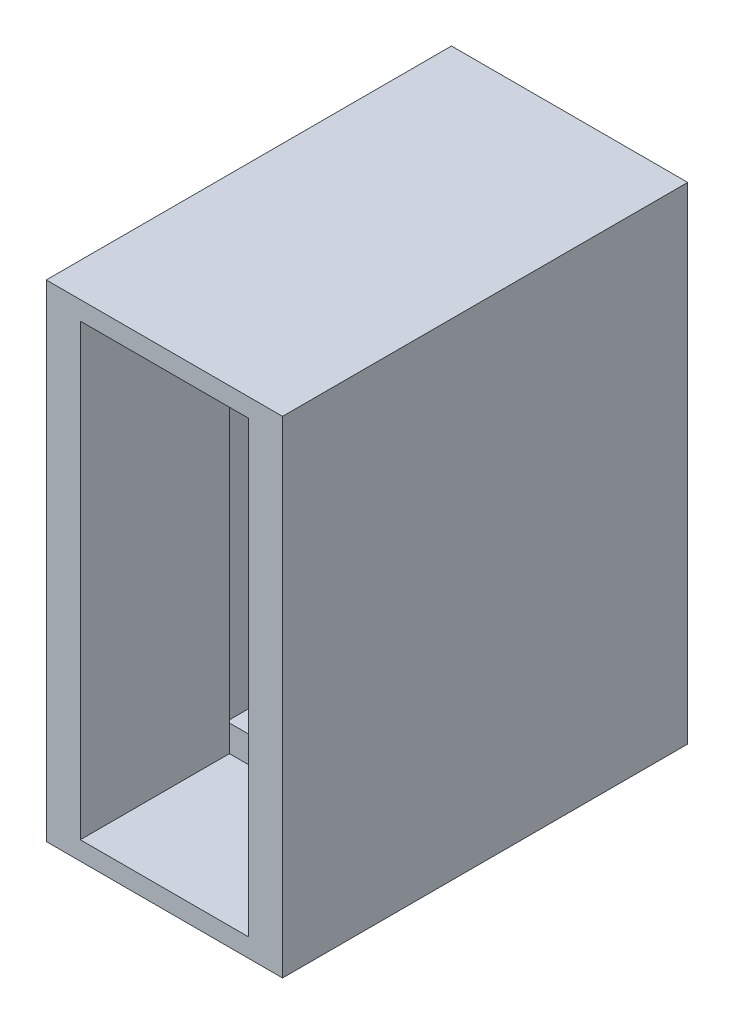
from build123d import *

# Parameters (mm, degrees)
SKETCH2_W           = 17
SKETCH2_H           = 35
BOSS_EXTRUDE1_DEPTH = 40
SKETCH3_W           = 12.1
SKETCH3_H           = 32.32
CUT_EXTRUDE1_DEPTH  = 10.73
SKETCH4_W           = 12.5
SKETCH4_H           = 28.5
CUT_EXTRUDE2_DEPTH  = 17
SKETCH6_W           = 9
SKETCH6_H           = 6.5
CUT_EXTRUDE3_DEPTH  = 17
SKETCH7_W           = 10.843475329
SKETCH7_H           = 35
CUT_EXTRUDE4_DEPTH  = 56.803225713


with BuildPart() as part:
    # Sketch2 → Boss-Extrude1 (new body)
    with BuildSketch(Plane.XY):
        with Locations((-8.5, 17.5)):
            Rectangle(SKETCH2_W, SKETCH2_H)
    extrude(amount=BOSS_EXTRUDE1_DEPTH)

    # Sketch3 → Cut-Extrude1 (cut)
    with BuildSketch(Plane.XY.offset(40)):
        with Locations((-8.5, 17.5)):
            Rectangle(SKETCH3_W, SKETCH3_H)
    extrude(amount=-CUT_EXTRUDE1_DEPTH, mode=Mode.SUBTRACT)

    # Sketch4 → Cut-Extrude2 (cut)
    with BuildSketch(Plane.XY.offset(29.27)):
        with Locations((-8.5, 17.5)):
            Rectangle(SKETCH4_W, SKETCH4_H)
    extrude(amount=-CUT_EXTRUDE2_DEPTH, mode=Mode.SUBTRACT)

    # Sketch6 → Cut-Extrude3 (cut)
    with BuildSketch(Plane(origin=(0, 3.25, 0), x_dir=(1, 0, 0), z_dir=(0, 1, 0))):
        with Locations((-8.5, -17.044771265)):
            Rectangle(SKETCH6_W, SKETCH6_H)
    extrude(amount=-CUT_EXTRUDE3_DEPTH, mode=Mode.SUBTRACT)

    # Sketch7 → Cut-Extrude4 (cut, through all)
    with BuildSketch(Plane.ZY.offset(17)):
        with Locations((5.421737665, 17.5)):
            Rectangle(SKETCH7_W, SKETCH7_H)
    extrude(amount=-CUT_EXTRUDE4_DEPTH, mode=Mode.SUBTRACT)


solid = part.part
